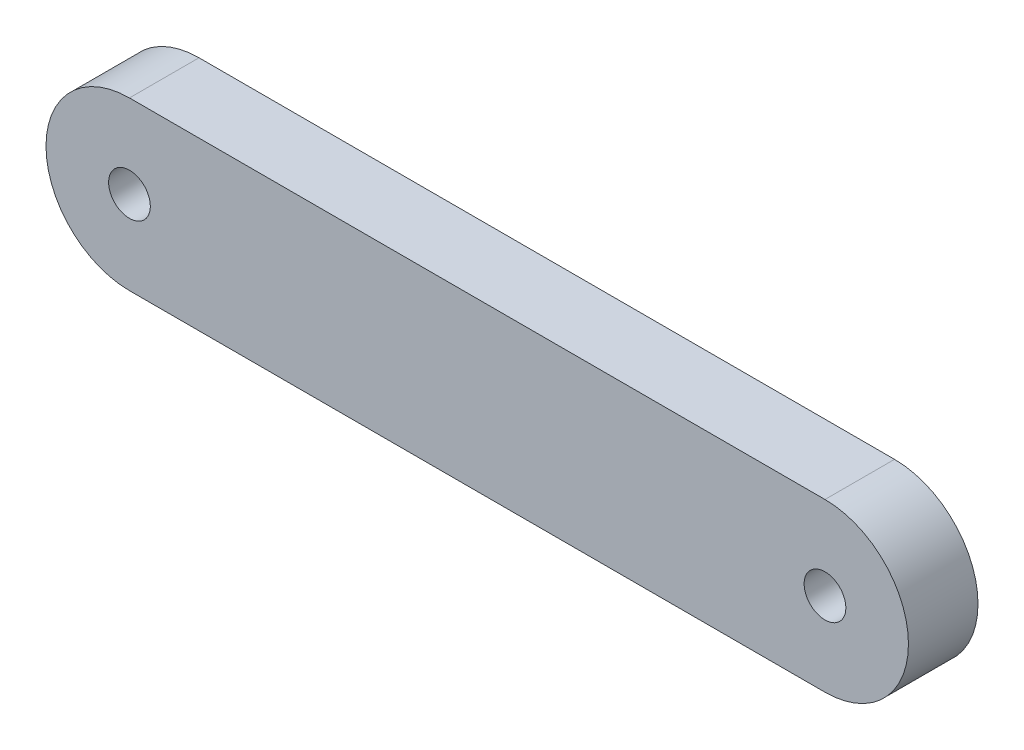
from build123d import *

# Parameters (mm, degrees)
ESQUISSE1_R        = 1.5
BOSS_EXTRU_1_DEPTH = 5


with BuildPart() as part:
    # Esquisse1 → Boss.-Extru.1 (new body)
    with BuildSketch(Plane.XY):
        with BuildLine():
            Line((-25, 6), (25, 6))
            ThreePointArc((25, 6), (31, 0), (25, -6))
            Line((25, -6), (-25, -6))
            ThreePointArc((-25, -6), (-31, 0), (-25, 6))
        make_face()
        with Locations((-25, 0)):
            Circle(ESQUISSE1_R, mode=Mode.SUBTRACT)
        with Locations((25, 0)):
            Circle(ESQUISSE1_R, mode=Mode.SUBTRACT)
    extrude(amount=BOSS_EXTRU_1_DEPTH)


solid = part.part
